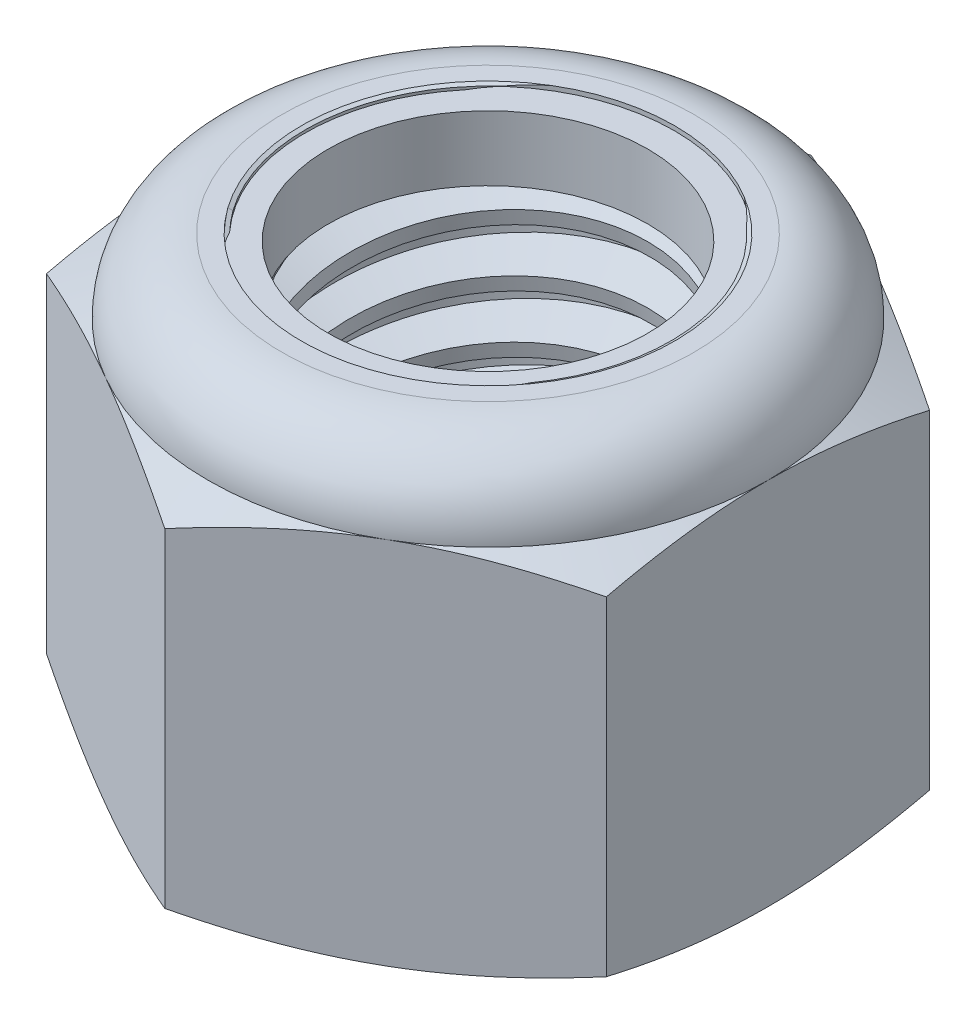
from build123d import *

# Parameters (mm, degrees)
EXTRUDE1_DEPTH      = 15.08125
SKETCH2_W           = 6.35
SKETCH2_H           = 15.08125
LPATTERN1_COUNT     = 8
LPATTERN1_PITCH     = 1.953846154
LPATTERN1_COL_COUNT = 2
LPATTERN1_COL_PITCH = 1.953846154


with BuildPart() as part:
    # Sketch1 → Extrude1 (new body)
    with BuildSketch(Plane(origin=(0, 0, 0), x_dir=(1, 0, 0), z_dir=(0, 1, 0))):
        Polygon((0, 10.998522628), (-9.525, 5.499261314), (-9.525, -5.499261314), (0, -10.998522628), (9.525, -5.499261314), (9.525, 5.499261314), align=None)
    extrude(amount=EXTRUDE1_DEPTH)

    # Sketch4 → Cut-Revolve2 (revolve, cut)
    with BuildSketch(Plane(origin=(0, 0, 0), x_dir=(0, 0, -1), z_dir=(1, 0, 0)), mode=Mode.PRIVATE) as cut_revolve2_sk:
        Polygon((0, 15.08125), (6.35, 15.08125), (5.434726912, 14.65445115), (5.434726912, 0.42679885), (6.35, 0), (0, 0), align=None)
    revolve(cut_revolve2_sk.sketch.rotate(Axis((0, 15.08125, 0), (0, 1, 0)), 55.034193324), axis=Axis((0, 15.08125, 0), (0, 1, 0)), mode=Mode.SUBTRACT)


with BuildPart() as body_2:
    # Sketch2 → Revolve1 (revolve)
    with BuildSketch(Plane(origin=(0, 0, 0), x_dir=(0, 0, -1), z_dir=(1, 0, 0))):
        with Locations((3.175, 7.540625)):
            Rectangle(SKETCH2_W, SKETCH2_H)
    revolve(axis=Axis((0, -6.35, 0), (0, 1, 0)))

    # Sketch3 → Cut-Revolve1 (revolve, cut)
    with BuildSketch(Plane(origin=(0, 0, 0), x_dir=(0, 0, -1), z_dir=(1, 0, 0)), mode=Mode.PRIVATE) as cut_revolve1_sk:
        Polygon((6.387137043, 14.83985922), (6.647096345, 13.15012376), (5.509000998, 13.592792596), (5.434726912, 14.075574156), align=None)
    cut_revolve1 = revolve(cut_revolve1_sk.sketch.rotate(Axis((0, 15.08125, 0.321367977), (0, -0.9883716976506172, -0.15205718425394138)), 180), axis=Axis((0, 15.08125, 0.321367977), (0, -0.9883716976506172, -0.15205718425394138)), mode=Mode.SUBTRACT)

    # LPattern1: Cut-Revolve1 ×8
    with Locations(*[(0, -i * LPATTERN1_PITCH, 0) for i in range(1, LPATTERN1_COUNT)]):
        add(cut_revolve1, mode=Mode.SUBTRACT)

    # LPattern1 col: Cut-Revolve1 ×2
    with Locations(*[(0, i * LPATTERN1_COL_PITCH, 0) for i in range(1, LPATTERN1_COL_COUNT)]):
        add(cut_revolve1, mode=Mode.SUBTRACT)


with BuildPart() as part_1:
    add(part.part)

    # Combine1: cut body 2
    add(body_2.part, mode=Mode.SUBTRACT)

    # Sketch5 → Cut-Revolve3 (revolve, cut)
    with BuildSketch(Plane(origin=(0, 0, 0), x_dir=(0, 0, -1), z_dir=(1, 0, 0)), mode=Mode.PRIVATE) as cut_revolve3_sk:
        with BuildLine():
            Line((0, 0), (9.525, 0))
            Line((9.525, 0), (10.998522628, 0.687114886))
            Line((10.998522628, 0.687114886), (10.998522628, 11.880593447))
            Line((10.998522628, 11.880593447), (9.525, 12.567708333))
            ThreePointArc((9.525, 12.567708333), (8.788800691, 14.345050691), (7.011458333, 15.08125))
            Line((7.011458333, 15.08125), (7.011458333, 16.35125))
            Line((7.011458333, 16.35125), (12.268522628, 16.35125))
            Line((12.268522628, 16.35125), (12.268522628, -1.27))
            Line((12.268522628, -1.27), (0, -1.27))
            Line((0, -1.27), (0, 0))
        make_face()
    revolve(cut_revolve3_sk.sketch.rotate(Axis((0, 0, 0), (0, 1, 0)), 55.034193324), axis=Axis((0, 0, 0), (0, 1, 0)), mode=Mode.SUBTRACT)

    # Sketch6 → Cut-Revolve4 (revolve, cut)
    with BuildSketch(Plane(origin=(0, 0, 0), x_dir=(0, 0, -1), z_dir=(1, 0, 0)), mode=Mode.PRIVATE) as cut_revolve4_sk:
        with BuildLine():
            Line((0, 12.567708333), (9.3726, 12.567708333))
            ThreePointArc((9.3726, 12.567708333), (8.681037617, 14.237287617), (7.011458333, 14.92885))
            Line((7.011458333, 14.92885), (6.223092623, 14.92885))
            Line((6.223092623, 14.92885), (6.223092623, 16.35125))
            Line((6.223092623, 16.35125), (0, 16.35125))
            Line((0, 16.35125), (0, 12.567708333))
        make_face()
    revolve(cut_revolve4_sk.sketch.rotate(Axis((0, 16.35125, 0), (0, 1, 0)), 55.034193324), axis=Axis((0, 16.35125, 0), (0, 1, 0)), mode=Mode.SUBTRACT)


with BuildPart() as body_2_2:
    # Sketch7 → Revolve2 (revolve)
    with BuildSketch(Plane(origin=(0, 0, 0), x_dir=(0, 0, -1), z_dir=(1, 0, 0)), mode=Mode.PRIVATE) as revolve2_sk:
        with BuildLine():
            Line((5.434726912, 12.643908333), (9.295129058, 12.643908333))
            ThreePointArc((9.295129058, 12.643908333), (8.599986877, 14.210125907), (7.011458333, 14.85265))
            Line((7.011458333, 14.85265), (5.434726912, 14.85265))
            Line((5.434726912, 14.85265), (5.434726912, 12.643908333))
        make_face()
    revolve(revolve2_sk.sketch.rotate(Axis((0, 12.643908333, 0), (0, 1, 0)), 55.034193324), axis=Axis((0, 12.643908333, 0), (0, 1, 0)))


solid = Compound([part_1.part, body_2_2.part])
